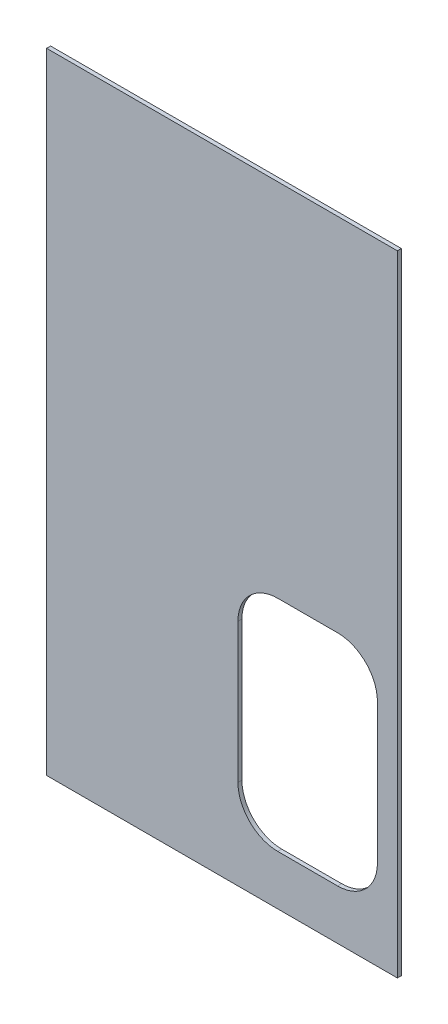
from build123d import *

# Parameters (mm, degrees)
ESQUISSE1_W        = 176
ESQUISSE1_H        = 316
ESQUISSE1_W_2      = 70
ESQUISSE1_H_2      = 110
BOSS_EXTRU_1_DEPTH = 2
CONG_1_R           = 20


with BuildPart() as part:
    # Esquisse1 → Boss.-Extru.1 (new body)
    with BuildSketch(Plane.XY):
        with Locations((88, 158)):
            Rectangle(ESQUISSE1_W, ESQUISSE1_H)
        with Locations((131, 80)):
            Rectangle(ESQUISSE1_W_2, ESQUISSE1_H_2, mode=Mode.SUBTRACT)
    extrude(amount=BOSS_EXTRU_1_DEPTH)

    # Congé1
    cong_1_edges = [part.edges().sort_by_distance(p)[0] for p in [
        (166, 25, 1),
        (166, 135, 1),
        (96, 135, 1),
        (96, 25, 1),
    ]]
    fillet(cong_1_edges, radius=CONG_1_R)


solid = part.part
